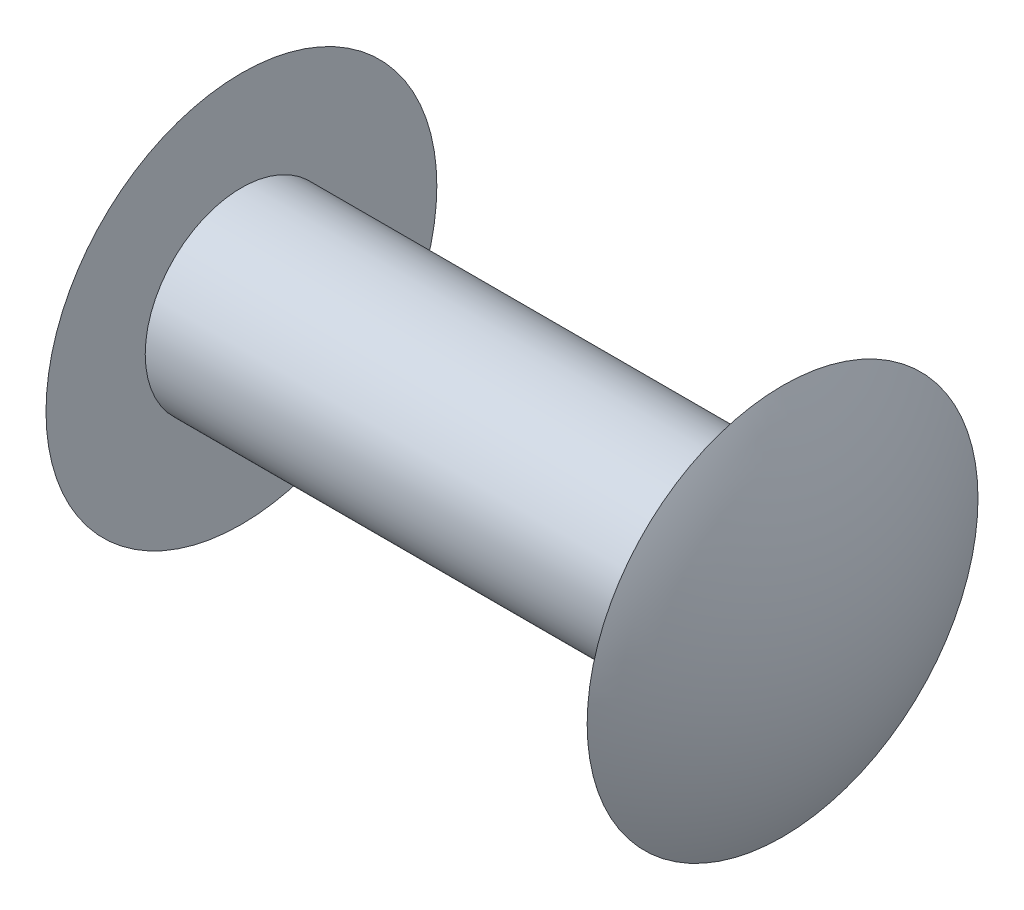
from build123d import *


with BuildPart() as part:
    # Sketch1 → Revolve1 (revolve)
    with BuildSketch(Plane.XY):
        with BuildLine():
            Line((0, 3.25), (0, 1.6))
            Line((0, 1.6), (9, 1.6))
            Line((9, 1.6), (9, 3.25))
            ThreePointArc((9, 3.25), (9.597058863, 1.673506797), (9.8, 0))
            Line((9.8, 0), (-0.8, 0))
            ThreePointArc((-0.8, 0), (-0.597058863, 1.673506797), (0, 3.25))
        make_face()
    revolve(axis=Axis((8.753512056, 0, 0), (-1, 0, 0)))


solid = part.part
